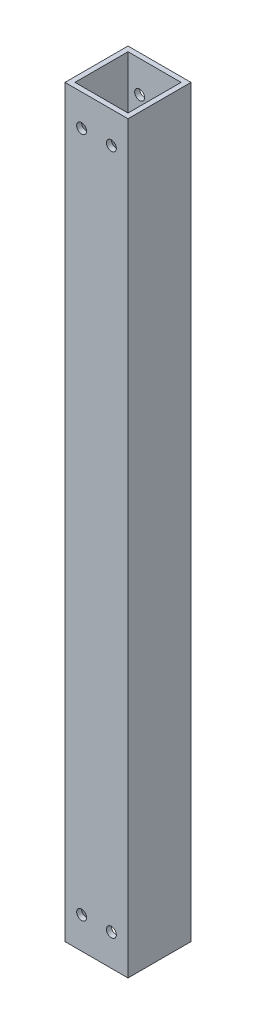
from build123d import *

# Parameters (mm, degrees)
SKETCH1_W               = 25.4
SKETCH1_H               = 25.4
SKETCH1_W_2             = 21.4
SKETCH1_H_2             = 21.4
BOSS_EXTRUDE1_DEPTH     = 300
CUT_EXTRUDE1_DEPTH      = 302.341085815
CUT_EXTRUDE1_DEPTH_BACK = 302.341085815
SKETCH2_R               = 2


with BuildPart() as part:
    # Sketch1 → Boss-Extrude1 (new body)
    with BuildSketch(Plane(origin=(0, 0, 0), x_dir=(1, 0, 0), z_dir=(0, 1, 0))):
        Rectangle(SKETCH1_W, SKETCH1_H)
        Rectangle(SKETCH1_W_2, SKETCH1_H_2, mode=Mode.SUBTRACT)
    extrude(amount=BOSS_EXTRUDE1_DEPTH)

    # Sketch2 → Cut-Extrude1 (cut, two sides: drawn at the far end of the back side and taken through both)
    with BuildSketch(Plane.XY.offset(12.7).offset(-CUT_EXTRUDE1_DEPTH_BACK)):
        with Locations((-6, 12.7)):
            Circle(SKETCH2_R)
        with Locations((6, 12.7)):
            Circle(SKETCH2_R)
        with Locations((6, 287.3)):
            Circle(SKETCH2_R)
        with Locations((-6, 287.3)):
            Circle(SKETCH2_R)
    extrude(amount=CUT_EXTRUDE1_DEPTH + CUT_EXTRUDE1_DEPTH_BACK, mode=Mode.SUBTRACT)


solid = part.part
